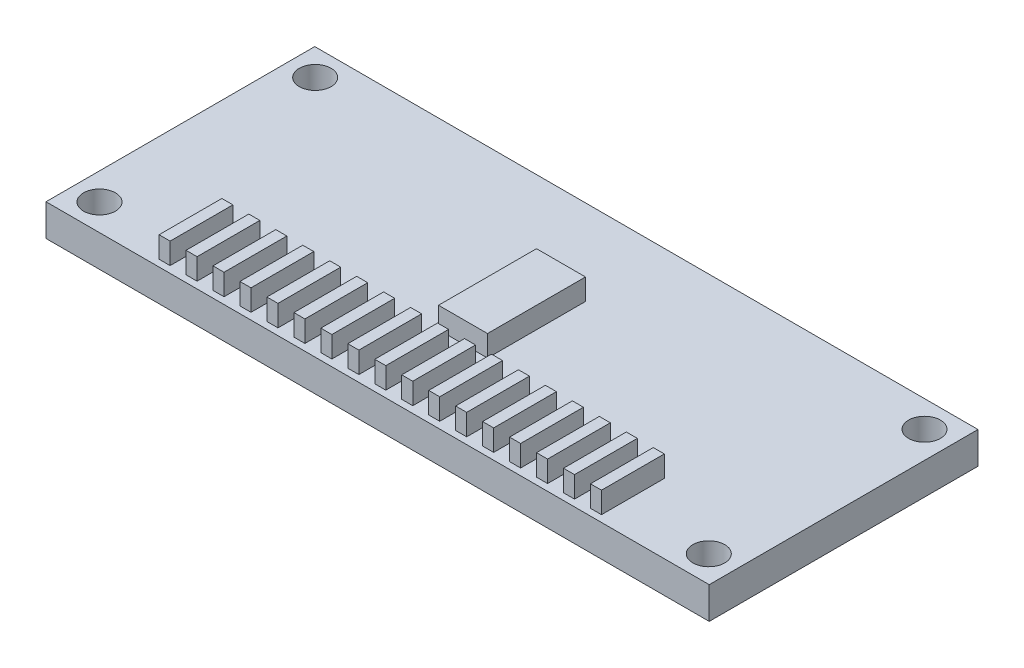
from build123d import *

# Parameters (mm, degrees)
SKETCH1_W           = 62.48
SKETCH1_H           = 25.32
SKETCH1_R           = 1.5
BOSS_EXTRUDE1_DEPTH = 3
SKETCH2_W           = 1.040030553
SKETCH2_H           = 5.915173771
SKETCH2_W_2         = 4.61513558
SKETCH2_H_2         = 9.230271158
BOSS_EXTRUDE2_DEPTH = 2


with BuildPart() as part:
    # Sketch1 → Boss-Extrude1 (new body)
    with BuildSketch(Plane(origin=(0, 0, 0), x_dir=(1, 0, 0), z_dir=(0, 1, 0))):
        Rectangle(SKETCH1_W, SKETCH1_H)
        with Locations(Location((28.7, 10.16, 0), (0, 0, 270))):
            Circle(SKETCH1_R, mode=Mode.SUBTRACT)
        with Locations(Location((28.7, -10.16, 0), (0, 0, 270))):
            Circle(SKETCH1_R, mode=Mode.SUBTRACT)
        with Locations(Location((-28.7, 10.16, 0), (0, 0, 270))):
            Circle(SKETCH1_R, mode=Mode.SUBTRACT)
        with Locations(Location((-28.7, -10.16, 0), (0, 0, 270))):
            Circle(SKETCH1_R, mode=Mode.SUBTRACT)
    extrude(amount=BOSS_EXTRUDE1_DEPTH)

    # Sketch2 → Boss-Extrude2 (add)
    with BuildSketch(Plane(origin=(0, 3, 0), x_dir=(1, 0, 0), z_dir=(0, 1, 0))):
        with Locations((-18.163108198, -9.067766385)):
            Rectangle(SKETCH2_W, SKETCH2_H)
        Rectangle(SKETCH2_W_2, SKETCH2_H_2)
        with Locations((-20.703108198, -9.067766385)):
            Rectangle(SKETCH2_W, SKETCH2_H)
        with Locations((-15.623108198, -9.067766385)):
            Rectangle(SKETCH2_W, SKETCH2_H)
        with Locations((-13.083108197, -9.067766385)):
            Rectangle(SKETCH2_W, SKETCH2_H)
        with Locations((-10.543108198, -9.067766385)):
            Rectangle(SKETCH2_W, SKETCH2_H)
        with Locations((-8.003108198, -9.067766385)):
            Rectangle(SKETCH2_W, SKETCH2_H)
        with Locations((-5.463108198, -9.067766385)):
            Rectangle(SKETCH2_W, SKETCH2_H)
        with Locations((-2.923108198, -9.067766385)):
            Rectangle(SKETCH2_W, SKETCH2_H)
        with Locations((-0.383108198, -9.067766385)):
            Rectangle(SKETCH2_W, SKETCH2_H)
        with Locations((2.156891803, -9.067766385)):
            Rectangle(SKETCH2_W, SKETCH2_H)
        with Locations((4.696891802, -9.067766385)):
            Rectangle(SKETCH2_W, SKETCH2_H)
        with Locations((7.236891803, -9.067766385)):
            Rectangle(SKETCH2_W, SKETCH2_H)
        with Locations((9.776891802, -9.067766385)):
            Rectangle(SKETCH2_W, SKETCH2_H)
        with Locations((12.316891803, -9.067766385)):
            Rectangle(SKETCH2_W, SKETCH2_H)
        with Locations((14.856891803, -9.067766385)):
            Rectangle(SKETCH2_W, SKETCH2_H)
        with Locations((17.396891803, -9.067766385)):
            Rectangle(SKETCH2_W, SKETCH2_H)
        with Locations((19.936891802, -9.067766385)):
            Rectangle(SKETCH2_W, SKETCH2_H)
    extrude(amount=BOSS_EXTRUDE2_DEPTH)


solid = part.part
